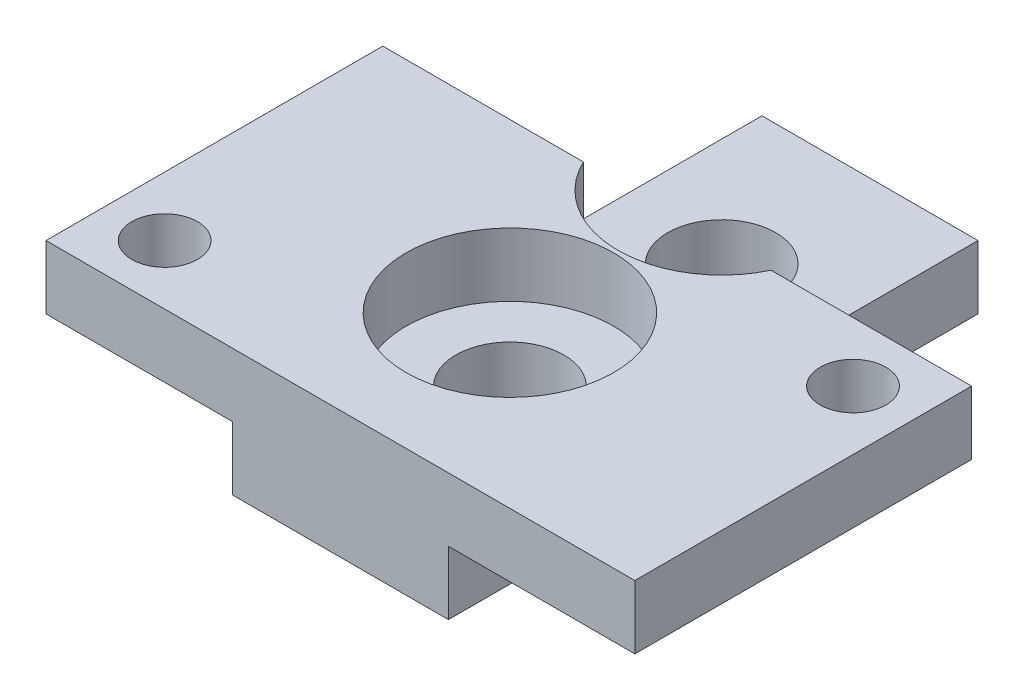
from build123d import *

# Parameters (mm, degrees)
SKETCH1_W           = 27.8
SKETCH1_H           = 15.9
SKETCH1_R           = 1.55
BOSS_EXTRUDE1_DEPTH = 3
SKETCH2_W           = 10.2
SKETCH2_H           = 25
BOSS_EXTRUDE2_DEPTH = 3
SKETCH3_R           = 2.55
CUT_EXTRUDE1_DEPTH  = 3
CUT_EXTRUDE4_START  = -3
SKETCH4_R           = 4.9
SKETCH4_R_2         = 2.55
CUT_EXTRUDE4_DEPTH  = 3


with BuildPart() as part:
    # Sketch1 → Boss-Extrude1 (new body)
    with BuildSketch(Plane(origin=(0, 0, 0), x_dir=(1, 0, 0), z_dir=(0, 1, 0))):
        with Locations((13.9, 7.95)):
            Rectangle(SKETCH1_W, SKETCH1_H)
        with Locations(Location((2.8, 2.8, 0), (0, 0, 270))):
            Circle(SKETCH1_R, mode=Mode.SUBTRACT)
        with Locations(Location((25, 13.1, 0), (0, 0, 270))):
            Circle(SKETCH1_R, mode=Mode.SUBTRACT)
    extrude(amount=BOSS_EXTRUDE1_DEPTH)

    # Sketch2 → Boss-Extrude2 (add)
    with BuildSketch(Plane.XZ):
        with Locations((13.9, -12.5)):
            Rectangle(SKETCH2_W, SKETCH2_H)
    extrude(amount=BOSS_EXTRUDE2_DEPTH)

    # Sketch3 → Cut-Extrude1 (cut)
    with BuildSketch(Plane.XZ.offset(3)):
        with Locations(Location((13.9, -8, 0), (0, 0, 270))):
            Circle(SKETCH3_R)
        with Locations(Location((13.9, -18, 0), (0, 0, 270))):
            Circle(SKETCH3_R)
    extrude(amount=-CUT_EXTRUDE1_DEPTH, mode=Mode.SUBTRACT)

    # Sketch4 → Cut-Extrude4 (cut)
    # profile 1 of 3: a face of its own
    with BuildSketch(Plane(origin=(0, 3, 0), x_dir=(1, 0, 0), z_dir=(0, 1, 0)).offset(CUT_EXTRUDE4_START)):
        with BuildLine():
            Line((18.327188724, 15.9), (15.346547614, 15.9))
            Line((15.346547614, 15.9), (12.453452386, 15.9))
            Line((12.453452386, 15.9), (9.472811276, 15.9))
            ThreePointArc((9.472811276, 15.9), (13.9, 13.1), (18.327188724, 15.9))
        make_face()
    # profile 2 of 3: a face of its own
    with BuildSketch(Plane(origin=(0, 3, 0), x_dir=(1, 0, 0), z_dir=(0, 1, 0)).offset(CUT_EXTRUDE4_START)):
        with Locations(Location((13.9, 8, 0), (0, 0, 270))):
            Circle(SKETCH4_R)
        with Locations(Location((13.9, 8, 0), (0, 0, 90))):
            Circle(SKETCH4_R_2, mode=Mode.SUBTRACT)
    # profile 3 of 3: a face of its own
    with BuildSketch(Plane(origin=(0, 3, 0), x_dir=(1, 0, 0), z_dir=(0, 1, 0)).offset(CUT_EXTRUDE4_START)):
        with Locations(Location((13.9, 8, 0), (0, 0, 90))):
            Circle(SKETCH4_R_2)
    extrude(amount=CUT_EXTRUDE4_DEPTH, mode=Mode.SUBTRACT)


solid = part.part
